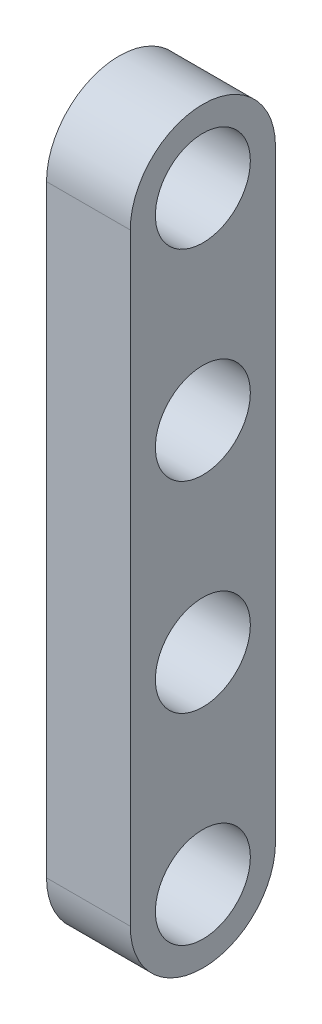
from build123d import *

# Parameters (mm, degrees)
SKETCH_1_R          = 2.835000467
SKETCH_1_R_2        = 2.835
EXTRUDE_1_DEPTH     = 5
CUT_EXTRUDE_START   = -5
CUT_EXTRUDE_1_DEPTH = 5


with BuildPart() as part:
    # Эскиз1 → Бобышка-Вытянуть1 (new body)
    with BuildSketch(Plane(origin=(0, 0, 0), x_dir=(0, 0, -1), z_dir=(1, 0, 0))):
        with BuildLine():
            Line((-4.835001402, 17.999999558), (-4.835001402, -18.000000151))
            ThreePointArc((-4.835001402, -18.000000151), (-9.35e-07, -22.835000618), (4.834999533, -18.000000151))
            Line((4.834999533, -18.000000151), (4.834999533, 17.999999558))
            ThreePointArc((4.834999533, 17.999999558), (-9.35e-07, 22.835000025), (-4.835001402, 17.999999558))
        make_face()
        with Locations((0, 17.999999684)):
            Circle(SKETCH_1_R, mode=Mode.SUBTRACT)
        with Locations((-3.97e-07, 5.999999684)):
            Circle(SKETCH_1_R_2, mode=Mode.SUBTRACT)
        with Locations((-4.67e-07, -6.000000151)):
            Circle(SKETCH_1_R_2, mode=Mode.SUBTRACT)
        with Locations((-4.67e-07, -18.000000151)):
            Circle(SKETCH_1_R_2, mode=Mode.SUBTRACT)
    extrude(amount=EXTRUDE_1_DEPTH)

    # Эскиз2 → Вырез-Вытянуть1 (cut)
    with BuildSketch(Plane(origin=(5, 0, 0), x_dir=(0, 0, -1), z_dir=(1, 0, 0)).offset(CUT_EXTRUDE_START)):
        with BuildLine():
            Line((-4.835001402, 17.999999558), (-4.835001402, -18.000000151))
            ThreePointArc((-4.835001402, -18.000000151), (-9.35e-07, -22.835000618), (4.834999533, -18.000000151))
            Line((4.834999533, -18.000000151), (4.834999533, 17.999999558))
            ThreePointArc((4.834999533, 17.999999558), (-9.35e-07, 22.835000025), (-4.835001402, 17.999999558))
        make_face()
        with BuildLine():
            Line((-4.335001402, 17.999999558), (-4.335001402, -18.000000151))
            ThreePointArc((-4.335001402, -18.000000151), (-9.35e-07, -22.335000618), (4.334999533, -18.000000151))
            Line((4.334999533, -18.000000151), (4.334999533, 17.999999558))
            ThreePointArc((4.334999533, 17.999999558), (-9.35e-07, 22.335000025), (-4.335001402, 17.999999558))
        make_face(mode=Mode.SUBTRACT)
    extrude(amount=CUT_EXTRUDE_1_DEPTH, mode=Mode.SUBTRACT)


solid = part.part
